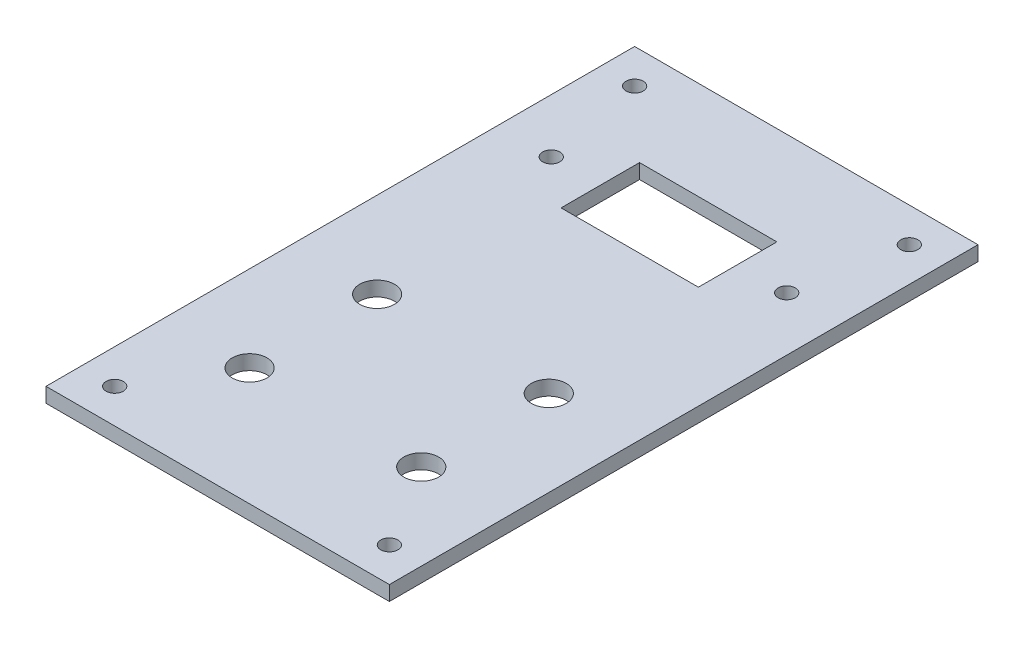
from build123d import *

# Parameters (mm, degrees)
SKETCH1_W           = 70
SKETCH1_H           = 120
BOSS_EXTRUDE1_DEPTH = 3
SKETCH2_R           = 1.75
SKETCH2_R_2         = 3.55
SKETCH2_W           = 28
SKETCH2_H           = 16
CUT_EXTRUDE1_DEPTH  = 3
SKETCH4_R           = 3.55
CUT_EXTRUDE2_DEPTH  = 12


with BuildPart() as part:
    # Sketch1 → Boss-Extrude1 (new body)
    with BuildSketch(Plane(origin=(0, 0, 0), x_dir=(1, 0, 0), z_dir=(0, 1, 0))):
        with Locations((35, 60)):
            Rectangle(SKETCH1_W, SKETCH1_H)
    extrude(amount=BOSS_EXTRUDE1_DEPTH)

    # Sketch2 → Cut-Extrude1 (cut)
    with BuildSketch(Plane(origin=(0, 3, 0), x_dir=(1, 0, 0), z_dir=(0, 1, 0))):
        with Locations(Location((11, 92, 0), (0, 0, 270))):
            Circle(SKETCH2_R)
        with Locations(Location((59, 92, 0), (0, 0, 270))):
            Circle(SKETCH2_R)
        with Locations(Location((52.5, 24, 0), (0, 0, 270))):
            Circle(SKETCH2_R_2)
        with Locations(Location((17.5, 24, 0), (0, 0, 270))):
            Circle(SKETCH2_R_2)
        with Locations(Location((7, 113, 0), (0, 0, 270))):
            Circle(SKETCH2_R)
        with Locations(Location((63, 113, 0), (0, 0, 270))):
            Circle(SKETCH2_R)
        with Locations(Location((63, 7, 0), (0, 0, 270))):
            Circle(SKETCH2_R)
        with Locations(Location((7, 7, 0), (0, 0, 270))):
            Circle(SKETCH2_R)
        with Locations((35, 92)):
            Rectangle(SKETCH2_W, SKETCH2_H)
    extrude(amount=-CUT_EXTRUDE1_DEPTH, mode=Mode.SUBTRACT)

    # Sketch4 → Cut-Extrude2 (cut)
    with BuildSketch(Plane(origin=(0, 3, 0), x_dir=(1, 0, 0), z_dir=(0, 1, 0))):
        with Locations(Location((17.5, 50, 0), (0, 0, 270))):
            Circle(SKETCH4_R)
        with Locations(Location((52.5, 50, 0), (0, 0, 270))):
            Circle(SKETCH4_R)
    extrude(amount=-CUT_EXTRUDE2_DEPTH, mode=Mode.SUBTRACT)


solid = part.part
